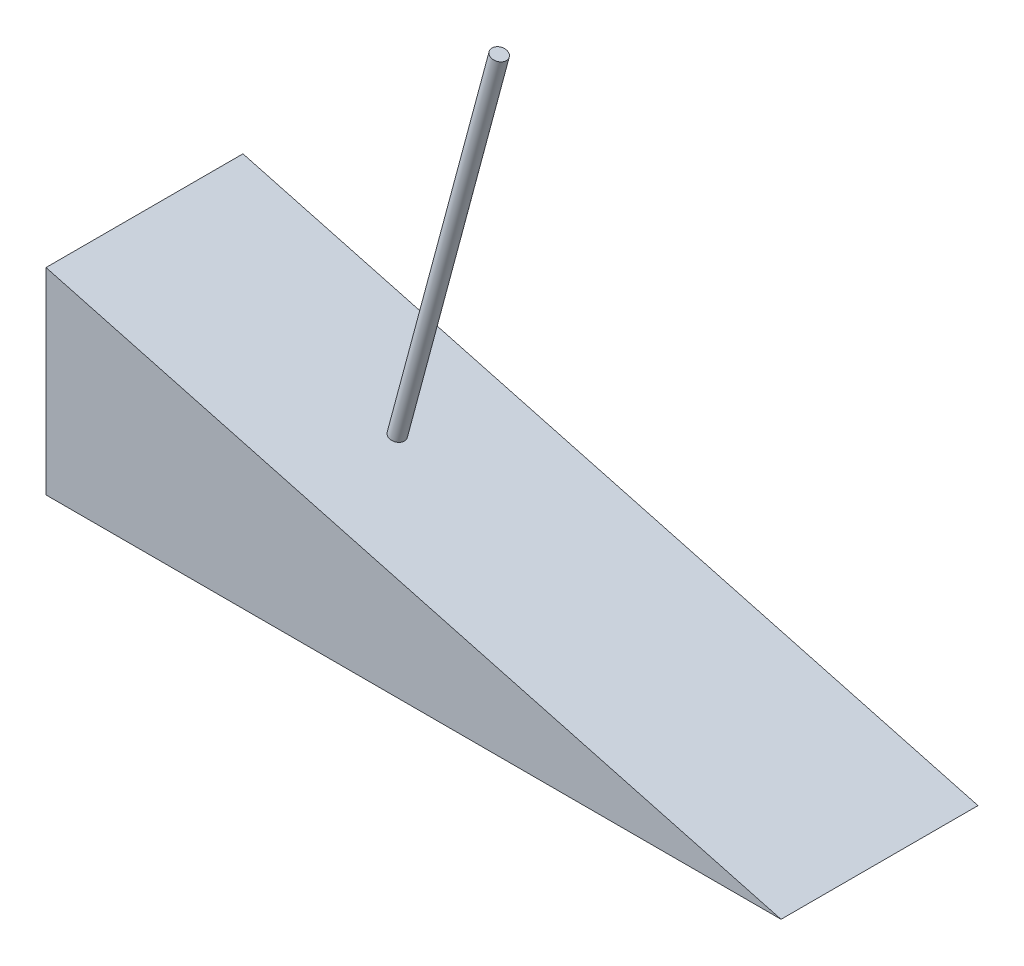
from build123d import *

# Parameters (mm, degrees)
BOSS_EXTRUDE1_DEPTH = 20
SKETCH2_R           = 0.75
BOSS_EXTRUDE2_DEPTH = 40


with BuildPart() as part:
    # Sketch1 → Boss-Extrude1 (new body)
    with BuildSketch(Plane.XY):
        Polygon((-22.150682767, 20), (52.490333384, 0), (-22.150682767, 0), align=None)
    extrude(amount=BOSS_EXTRUDE1_DEPTH)

    # Sketch2 → Boss-Extrude2 (add)
    with BuildSketch(Plane(origin=(3.51618561, 13.122583346, 0), x_dir=(0.96592582628907, -0.25881904510251424, 0), z_dir=(0.2588190451025143, 0.9659258262890701, 0))):
        with Locations((0, -10)):
            Circle(SKETCH2_R)
    extrude(amount=BOSS_EXTRUDE2_DEPTH)


solid = part.part
